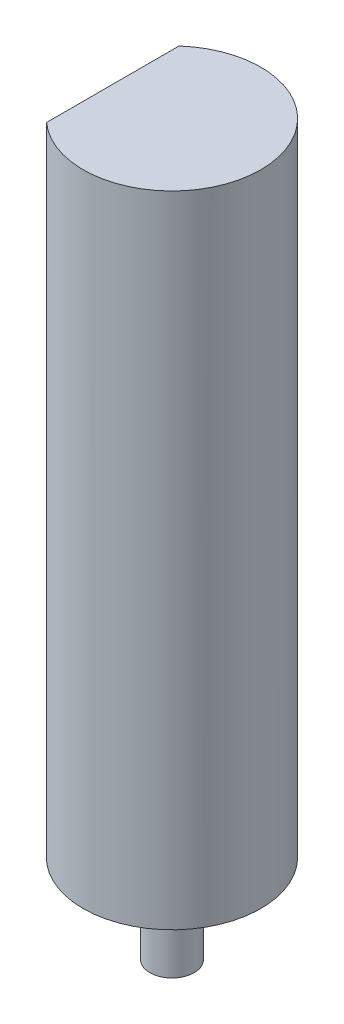
from build123d import *

# Parameters (mm, degrees)
SKETCH_1_R          = 1.5
EXTRUDE_1_DEPTH     = 10.8
CUT_EXTRUDE_START   = -6
CUT_EXTRUDE_1_DEPTH = 6
SKETCH_3_R          = 0.375
EXTRUDE_2_DEPTH     = 1.5


with BuildPart() as part:
    # Эскиз1 → Бобышка-Вытянуть1 (new body)
    with BuildSketch(Plane(origin=(0, 0, 0), x_dir=(1, 0, 0), z_dir=(0, 1, 0))):
        with Locations(Location((0, 0, 0), (0, 0, 90))):
            Circle(SKETCH_1_R)
    extrude(amount=EXTRUDE_1_DEPTH)

    # Эскиз2 → Вырез-Вытянуть1 (cut)
    with BuildSketch(Plane(origin=(0, 10.8, 0), x_dir=(1, 0, 0), z_dir=(0, 1, 0)).offset(CUT_EXTRUDE_START)):
        with BuildLine():
            Line((-1, -1.118033989), (-1, 1.118033989))
            ThreePointArc((-1, 1.118033989), (-1.5, 0), (-1, -1.118033989))
        make_face()
    extrude(amount=CUT_EXTRUDE_1_DEPTH, mode=Mode.SUBTRACT)

    # Эскиз3 → Бобышка-Вытянуть2 (add)
    with BuildSketch(Plane.XZ):
        with Locations(Location((0, 0, 0), (0, 0, 90))):
            Circle(SKETCH_3_R)
    extrude(amount=EXTRUDE_2_DEPTH)


solid = part.part
